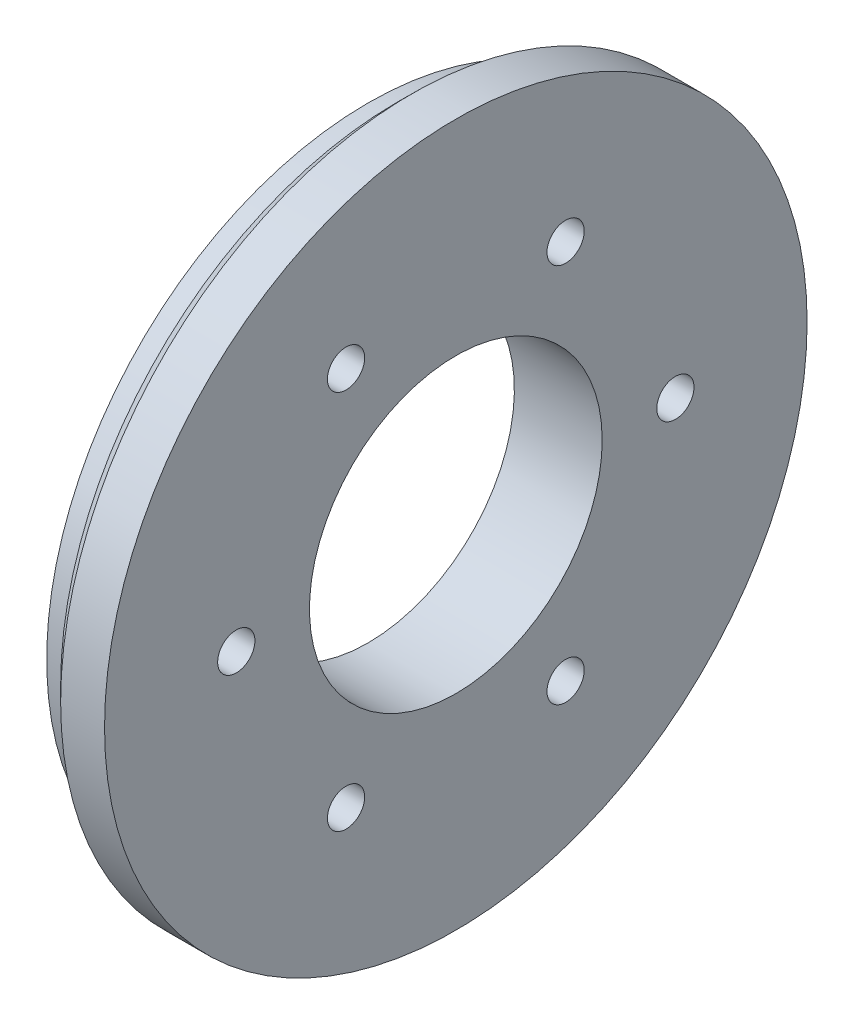
from build123d import *

# Parameters (mm, degrees)
SKETCH1_R           = 38.1
SKETCH1_R_2         = 15.875
SKETCH1_R_3         = 2.0193
BOSS_EXTRUDE1_DEPTH = 3.175
BOSS_EXTRUDE2_START = 3.175
SKETCH2_R           = 34.8488
SKETCH2_R_2         = 2.0193
SKETCH2_R_3         = 15.875
BOSS_EXTRUDE2_DEPTH = 3.175
CHAMFER1_SIZE       = 1.5875


with BuildPart() as part:
    # Sketch1 → Boss-Extrude1 (new, symmetric)
    with BuildSketch(Plane(origin=(0, 0, 0), x_dir=(0, 0, -1), z_dir=(1, 0, 0))):
        Circle(SKETCH1_R)
        Circle(SKETCH1_R_2, mode=Mode.SUBTRACT)
        with Locations((11.90625, 20.622229928)):
            Circle(SKETCH1_R_3, mode=Mode.SUBTRACT)
        with Locations((23.8125, 0)):
            Circle(SKETCH1_R_3, mode=Mode.SUBTRACT)
        with Locations((11.90625, -20.622229928)):
            Circle(SKETCH1_R_3, mode=Mode.SUBTRACT)
        with Locations((-11.90625, -20.622229928)):
            Circle(SKETCH1_R_3, mode=Mode.SUBTRACT)
        with Locations((-23.8125, 0)):
            Circle(SKETCH1_R_3, mode=Mode.SUBTRACT)
        with Locations((-11.90625, 20.622229928)):
            Circle(SKETCH1_R_3, mode=Mode.SUBTRACT)
    extrude(amount=BOSS_EXTRUDE1_DEPTH, both=True)

    # Sketch2 → Boss-Extrude2 (add)
    with BuildSketch(Plane.ZY.offset(3.175).offset(BOSS_EXTRUDE2_START)):
        with Locations(Location((0, 0, 0), (0, 0, 270))):
            Circle(SKETCH2_R)
        with Locations(Location((-11.90625, 20.622229928, 0), (0, 0, 270))):
            Circle(SKETCH2_R_2, mode=Mode.SUBTRACT)
        with Locations(Location((-11.90625, -20.622229928, 0), (0, 0, 270))):
            Circle(SKETCH2_R_2, mode=Mode.SUBTRACT)
        with Locations(Location((23.8125, 0, 0), (0, 0, 270))):
            Circle(SKETCH2_R_2, mode=Mode.SUBTRACT)
        with Locations(Location((11.90625, 20.622229928, 0), (0, 0, 270))):
            Circle(SKETCH2_R_2, mode=Mode.SUBTRACT)
        with Locations(Location((11.90625, -20.622229928, 0), (0, 0, 270))):
            Circle(SKETCH2_R_2, mode=Mode.SUBTRACT)
        with Locations(Location((-23.8125, 0, 0), (0, 0, 270))):
            Circle(SKETCH2_R_2, mode=Mode.SUBTRACT)
        with Locations(Location((0, 0, 0), (0, 0, 270))):
            Circle(SKETCH2_R_3, mode=Mode.SUBTRACT)
    extrude(amount=-BOSS_EXTRUDE2_DEPTH)

    # Chamfer1
    chamfer1_edges = [part.edges().sort_by_distance(p)[0] for p in [
        (-3.175, 0, 38.1),
    ]]
    chamfer(chamfer1_edges, length=CHAMFER1_SIZE)


solid = part.part
